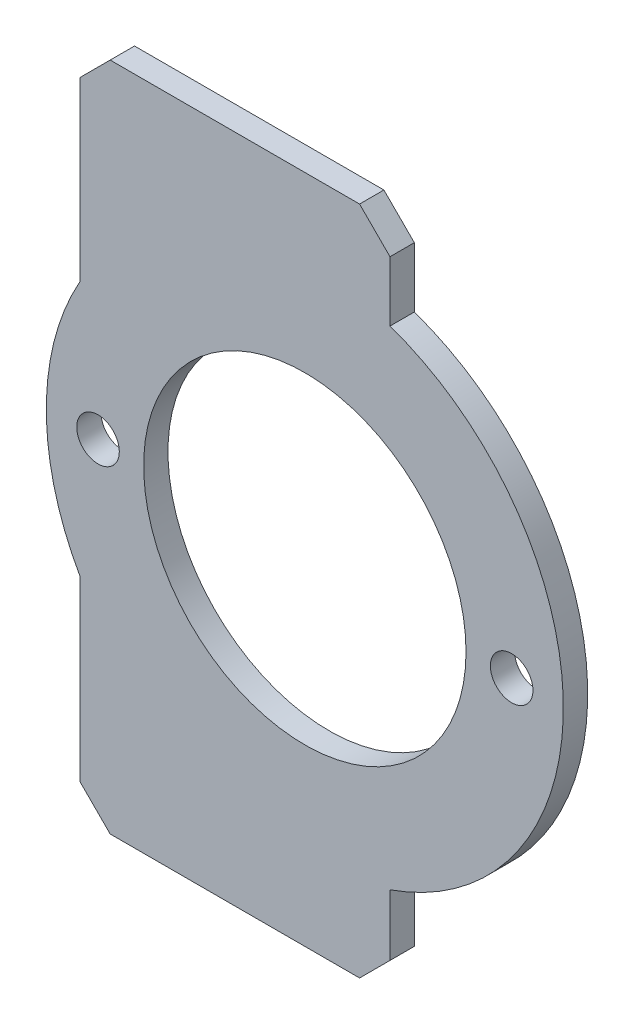
from build123d import *

# Parameters (mm, degrees)
SKETCH1_R           = 42.5
SKETCH1_R_2         = 26.5
SKETCH1_R_3         = 3.5
BOSS_EXTRUDE1_DEPTH = 4
BOSS_EXTRUDE2_DEPTH = 4
CHAMFER1_SIZE       = 5


with BuildPart() as part:
    # Sketch1 → Boss-Extrude1 (new body)
    with BuildSketch(Plane.XY):
        Circle(SKETCH1_R)
        Circle(SKETCH1_R_2, mode=Mode.SUBTRACT)
        with Locations((34, 0)):
            Circle(SKETCH1_R_3, mode=Mode.SUBTRACT)
        with Locations((-34, 0)):
            Circle(SKETCH1_R_3, mode=Mode.SUBTRACT)
    extrude(amount=-BOSS_EXTRUDE1_DEPTH)

    # Sketch2 → Boss-Extrude2 (add)
    with BuildSketch(Plane.XY):
        Polygon((-37, 55), (-37, 20.910523666), (14, 40.127920454), (14, 55), align=None)
        Polygon((-37, -55.188269352), (-37, -20.910523666), (14, -40.127920454), (14, -55.188269352), align=None)
    extrude(amount=-BOSS_EXTRUDE2_DEPTH)

    # Chamfer1
    chamfer1_edges = [part.edges().sort_by_distance(p)[0] for p in [
        (-37, 55, -2),
        (14, 55, -2),
        (14, -55.188269352, -2),
        (-37, -55.188269352, -2),
    ]]
    chamfer(chamfer1_edges, length=CHAMFER1_SIZE)


solid = part.part
